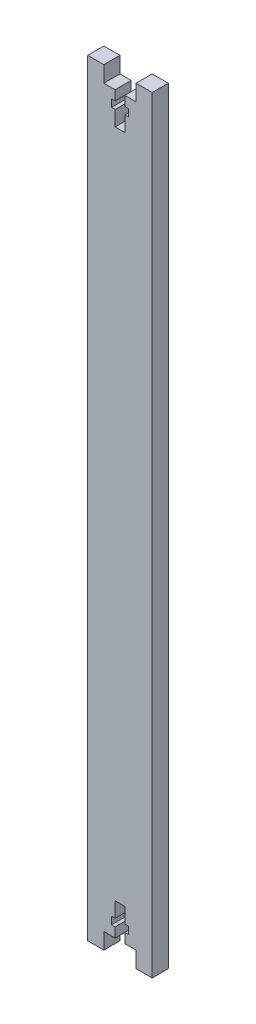
from build123d import *

# Parameters (mm, degrees)
BOSS_EXTRUDE1_DEPTH = 5


with BuildPart() as part:
    # Sketch1 → Boss-Extrude1 (new body)
    with BuildSketch(Plane.XY):
        Polygon((11.5, 233), (15, 233), (15, 238), (20, 238), (20, 233), (20, 5), (20, 0), (15, 0), (15, 5), (11.5, 5), (11.5, 8), (12.6, 8), (12.6, 10.3), (11.5, 10.3), (11.5, 15), (8.5, 15), (8.5, 10.3), (7.4, 10.3), (7.4, 8), (8.5, 8), (8.5, 5), (5, 5), (5, 0), (0, 0), (0, 5), (0, 233), (0, 238), (5, 238), (5, 233), (8.5, 233), (8.5, 230), (7.4, 230), (7.4, 227.7), (8.5, 227.7), (8.5, 223), (11.5, 223), (11.5, 227.7), (12.6, 227.7), (12.6, 230), (11.5, 230), align=None)
    extrude(amount=BOSS_EXTRUDE1_DEPTH)


solid = part.part
